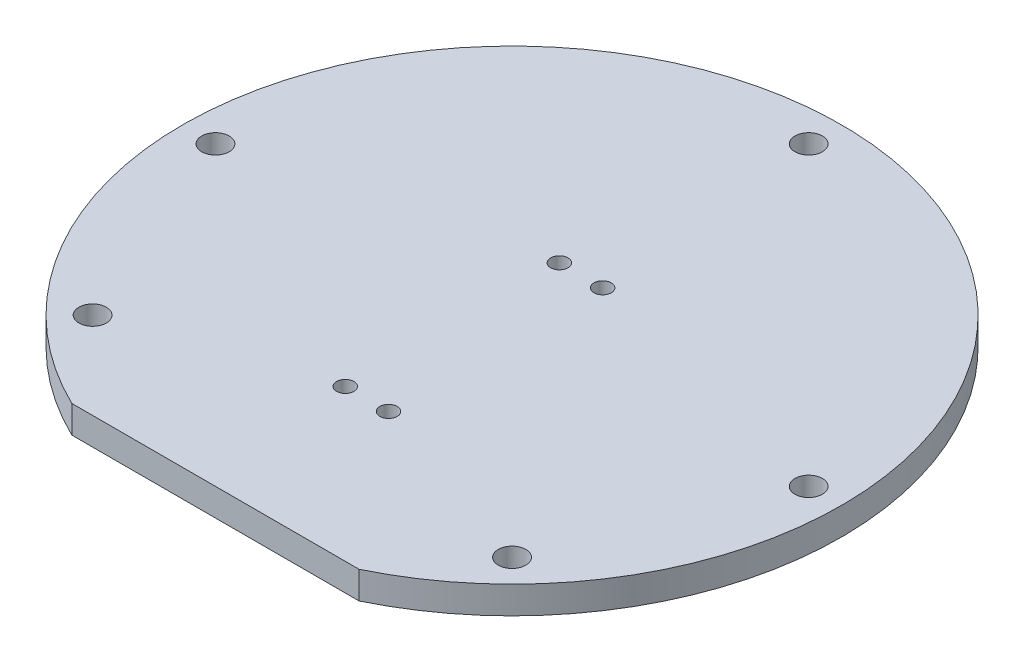
from build123d import *

# Parameters (mm, degrees)
SKETCH1_R           = 3.175
SKETCH1_R_2         = 2
BOSS_EXTRUDE1_DEPTH = 6.35


with BuildPart() as part:
    # Sketch1 → Boss-Extrude1 (new body)
    with BuildSketch(Plane(origin=(0, 0, 0), x_dir=(1, 0, 0), z_dir=(0, 1, 0))):
        with BuildLine():
            Line((-33.21480995, -68.58), (33.21480995, -68.58))
            ThreePointArc((33.21480995, -68.58), (64.565503631, -40.46894786), (76.2, 0))
            ThreePointArc((76.2, 0), (-40.46894786, 64.565503631), (-33.21480995, -68.58))
        make_face()
        with Locations(Location((-48.493383054, -48.493383054, 0), (0, 0, 270))):
            Circle(SKETCH1_R, mode=Mode.SUBTRACT)
        with Locations(Location((-5.0038, -33.563454663, 0), (0, 0, 270))):
            Circle(SKETCH1_R_2, mode=Mode.SUBTRACT)
        with Locations(Location((48.493383054, -48.493383054, 0), (0, 0, 270))):
            Circle(SKETCH1_R, mode=Mode.SUBTRACT)
        with Locations(Location((5.0038, -33.563454663, 0), (0, 0, 270))):
            Circle(SKETCH1_R_2, mode=Mode.SUBTRACT)
        with Locations(Location((-68.58, 0, 0), (0, 0, 270))):
            Circle(SKETCH1_R, mode=Mode.SUBTRACT)
        with Locations(Location((-5.0038, 15.941145337, 0), (0, 0, 270))):
            Circle(SKETCH1_R_2, mode=Mode.SUBTRACT)
        with Locations(Location((5.0038, 15.941145337, 0), (0, 0, 270))):
            Circle(SKETCH1_R_2, mode=Mode.SUBTRACT)
        with Locations(Location((68.58, 0, 0), (0, 0, 270))):
            Circle(SKETCH1_R, mode=Mode.SUBTRACT)
        with Locations(Location((0, 68.58, 0), (0, 0, 270))):
            Circle(SKETCH1_R, mode=Mode.SUBTRACT)
    extrude(amount=BOSS_EXTRUDE1_DEPTH)


solid = part.part
